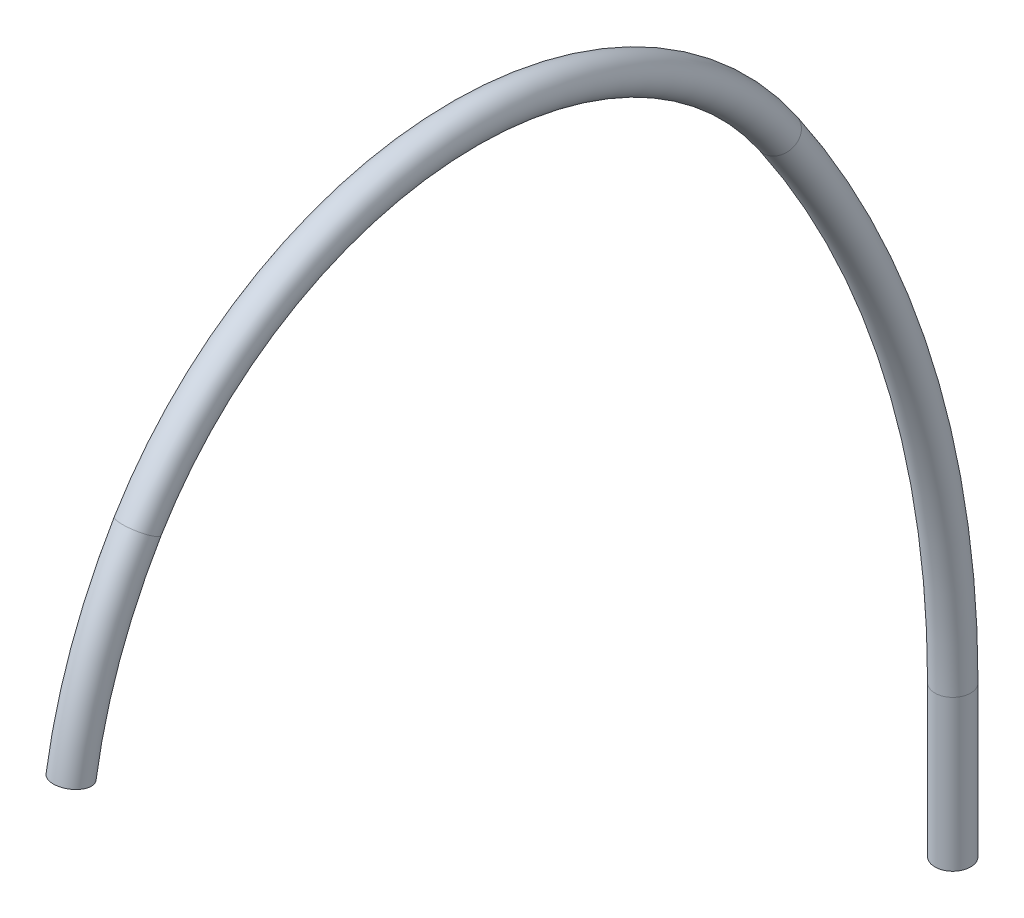
from build123d import *

# Parameters (mm, degrees)
CROQUIS7_R = 5
VACIADO2_T = -1


with BuildPart() as part:
    # Barrer1: sweep along a path in Croquis5
    with BuildLine(Plane(origin=(0, 0, 0), x_dir=(0, 0, -1), z_dir=(1, 0, 0))) as barrer1_path:
        Line((-12, 40), (-12, 82.205417262))
        ThreePointArc((-12, 82.205417262), (-24.504001915, 164.787410469), (-60.895042363, 239.966049996))
        ThreePointArc((-60.895042363, 239.966049996), (-152.17492097, 286.268958564), (-240.428407671, 234.429806704))
        ThreePointArc((-240.428407671, 234.429806704), (-252.247213038, 209.547863063), (-259.101430107, 182.868001969))
    # Croquis7 → Barrer1 (sweep)
    with BuildSketch(Plane(origin=(0, 40, 12), x_dir=(-1, 0, 0), z_dir=(0, 1, 0))):
        Circle(CROQUIS7_R)
    sweep(path=barrer1_path.line)

    # Vaciado2
    vaciado2_openings = [part.faces().sort_by_distance(p)[0] for p in [
        (0, 182.868001969, 259.101430107),
        (0, 40, 12),
    ]]
    offset(amount=VACIADO2_T, openings=vaciado2_openings, kind=Kind.INTERSECTION)


solid = part.part
